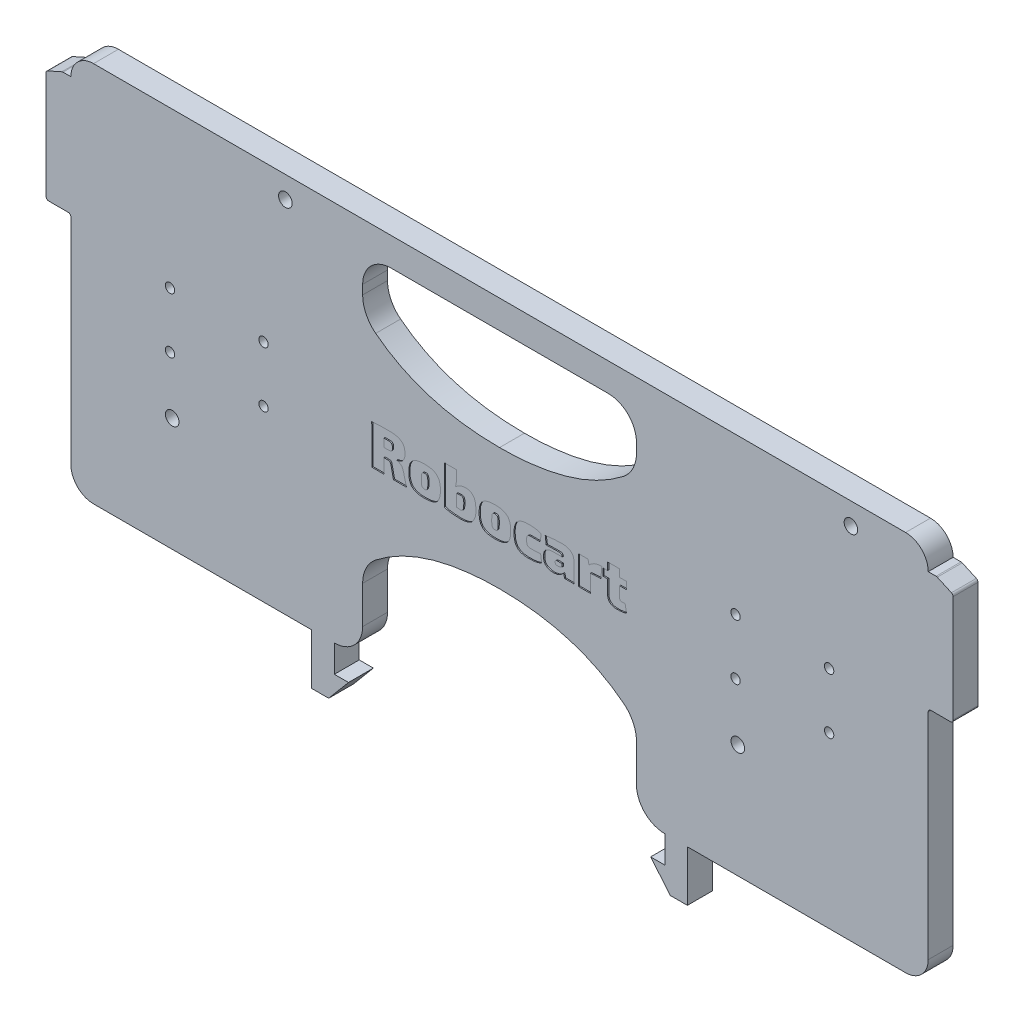
from build123d import *

# Parameters (mm, degrees)
SKETCH1_R           = 1.05
SKETCH1_R_2         = 1.524
BOSS_EXTRUDE1_DEPTH = 5.588
CUT_EXTRUDE1_DEPTH  = 0.254
SKETCH3_W           = 61.475112
SKETCH3_H           = 6.35
BOSS_EXTRUDE2_DEPTH = 5.588
FILLET1_R           = 5.08
FILLET2_R           = 6.35
FILLET3_R           = 7.62
BOSS_EXTRUDE3_DEPTH = 5.588
FILLET4_R           = 0.635
BOSS_EXTRUDE4_DEPTH = 5.588


with BuildPart() as part:
    # Sketch1 → Boss-Extrude1 (new body)
    with BuildSketch(Plane.XY):
        with BuildLine():
            Line((-96.237552, 42.800016), (-30.737556, 42.800016))
            Line((-30.737556, 42.800016), (-30.737556, 24.594089789))
            add(Edge.make_bspline(
                [(-30.737556, 24.594089789), (-19.663465212, 13.732458897), (0, 13.732458897)],
                knots=[0, 0, 0, 1, 1, 1], degree=2))
            add(Edge.make_bspline(
                [(30.737556, 24.594089789), (19.663465212, 13.732458897), (0, 13.732458897)],
                knots=[0, 0, 0, 1, 1, 1], degree=2))
            Line((30.737556, 24.594089789), (30.737556, 42.800016))
            Line((30.737556, 42.800016), (96.237552, 42.800016))
            Line((96.237552, 42.800016), (96.237552, -42.800016))
            Line((96.237552, -42.800016), (30.737556, -42.800016))
            Line((30.737556, -42.800016), (30.737556, -24.594089789))
            add(Edge.make_bspline(
                [(30.737556, -24.594089789), (19.663465212, -13.732458897), (0, -13.732458897)],
                knots=[0, 0, 0, 1, 1, 1], degree=2))
            add(Edge.make_bspline(
                [(-30.737556, -24.594089789), (-19.663465212, -13.732458897), (0, -13.732458897)],
                knots=[0, 0, 0, 1, 1, 1], degree=2))
            Line((-30.737556, -24.594089789), (-30.737556, -42.800016))
            Line((-30.737556, -42.800016), (-96.237552, -42.800016))
            Line((-96.237552, -42.800016), (-96.237552, 42.800016))
        make_face()
        with Locations((-73.987554, 7.775016)):
            Circle(SKETCH1_R, mode=Mode.SUBTRACT)
        with Locations((-73.987554, -4.724984)):
            Circle(SKETCH1_R, mode=Mode.SUBTRACT)
        with Locations((-73.48743494, -17.299967432)):
            Circle(SKETCH1_R_2, mode=Mode.SUBTRACT)
        with Locations((-52.987554, -4.724984)):
            Circle(SKETCH1_R, mode=Mode.SUBTRACT)
        with Locations((-52.987554, 7.775016)):
            Circle(SKETCH1_R, mode=Mode.SUBTRACT)
        with Locations((-48.08743494, 37.900032658)):
            Circle(SKETCH1_R_2, mode=Mode.SUBTRACT)
        with Locations((52.987554, 7.775016)):
            Circle(SKETCH1_R, mode=Mode.SUBTRACT)
        with Locations((52.987554, -4.724984)):
            Circle(SKETCH1_R, mode=Mode.SUBTRACT)
        with Locations((53.48767306, -17.299967432)):
            Circle(SKETCH1_R_2, mode=Mode.SUBTRACT)
        with Locations((73.987554, -4.724984)):
            Circle(SKETCH1_R, mode=Mode.SUBTRACT)
        with Locations((73.987554, 7.775016)):
            Circle(SKETCH1_R, mode=Mode.SUBTRACT)
        with Locations((78.88767306, 37.900032658)):
            Circle(SKETCH1_R_2, mode=Mode.SUBTRACT)
    extrude(amount=BOSS_EXTRUDE1_DEPTH)

    # Sketch2 → Cut-Extrude1 (cut)
    # profile 1 of 8: a face of its own
    with BuildSketch(Plane.XY.offset(5.588)):
        with BuildLine():
            Line((-20.890812959, -4.42227741), (-21.585380443, -1.716054946))
            add(Edge.make_bspline(
                [(-21.585380443, -1.716054946), (-21.60234828, -1.653306269), (-21.635292736, -1.531474533), (-21.691189114, -1.356694313), (-21.758925017, -1.19846087), (-21.832380902, -1.054165756), (-21.916098631, -0.926896435), (-22.004915512, -0.8132369), (-22.104350893, -0.71808226), (-22.243511952, -0.614257437), (-22.422280397, -0.513687987), (-22.633173863, -0.416456242), (-22.839405402, -0.350151259), (-22.977407352, -0.333891862), (-23.043977594, -0.326048553)],
                knots=[0, 0, 0, 0, 1.077305702, 2.091677954, 3.037688743, 3.926929695, 4.771153773, 5.558605575, 6.312393956, 7.044123723, 8.430977119, 9.701515358, 10.89124264, 12, 12, 12, 12], degree=3))
            Line((-23.043977594, -0.326048553), (-23.043202188, -0.24710396))
            add(Edge.make_bspline(
                [(-23.043202188, -0.24710396), (-22.961648182, -0.235586825), (-22.803433142, -0.213243544), (-22.576590253, -0.162297679), (-22.369683852, -0.092898274), (-22.181455484, -0.011293229), (-22.010290323, 0.082211519), (-21.861641634, 0.195300102), (-21.729587051, 0.319444944), (-21.62000232, 0.460350979), (-21.529137974, 0.611799621), (-21.444879897, 0.767621728), (-21.3802961, 0.933614593), (-21.322452804, 1.104979452), (-21.282907265, 1.284906948), (-21.255605422, 1.471537149), (-21.237278176, 1.664812301), (-21.23834801, 1.79623051), (-21.238892035, 1.863058292)],
                knots=[0, 0, 0, 0, 1.26978194, 2.463381128, 3.579096605, 4.629624065, 5.624356077, 6.577924219, 7.501901734, 8.4118476, 9.319542298, 10.223774319, 11.139249399, 12.061995962, 13.010448794, 13.974684905, 14.970102261, 16, 16, 16, 16], degree=3))
            add(Edge.make_bspline(
                [(-21.238892035, 1.863058292), (-21.240256716, 1.986242824), (-21.242884818, 2.223471436), (-21.284426706, 2.564530422), (-21.352323062, 2.876779758), (-21.447710673, 3.161146698), (-21.574491945, 3.415933184), (-21.730194324, 3.641304277), (-21.913280002, 3.83922773), (-22.129167363, 4.005448301), (-22.374164655, 4.147373318), (-22.650731763, 4.267903578), (-22.959865338, 4.36549173), (-23.298835066, 4.450868825), (-23.671491226, 4.509440489), (-24.075777802, 4.552186848), (-24.512417695, 4.573794748), (-24.813795877, 4.573580295), (-24.969649547, 4.573469393)],
                knots=[0, 0, 0, 0, 1.104208727, 2.126483719, 3.075171058, 3.966171587, 4.809496057, 5.618738063, 6.415337279, 7.217477855, 8.052665404, 8.949189943, 9.917359153, 10.957177015, 12.081428767, 13.297225691, 14.602296653, 16, 16, 16, 16], degree=3))
            add(Edge.make_bspline(
                [(-24.969649547, 4.573469393), (-25.171246857, 4.57383093), (-25.555893756, 4.574520739), (-26.1037831, 4.569878918), (-26.594232421, 4.565965796), (-27.173214222, 4.550526818), (-27.867258208, 4.519956874), (-28.415481015, 4.470497951), (-28.692986358, 4.445462298)],
                knots=[0, 0, 0, 0, 0.973558164, 1.857545264, 2.645999097, 3.342055079, 4.654572721, 6, 6, 6, 6], degree=3))
            Line((-28.692986358, 4.445462298), (-28.691132995, -4.42227741))
            Line((-28.691132995, -4.42227741), (-25.975154555, -4.42227741))
            Line((-25.975154555, -4.42227741), (-25.975154555, -1.205403453))
            Line((-25.975154555, -1.205403453), (-25.131903106, -1.205403453))
            add(Edge.make_bspline(
                [(-25.131903106, -1.205403453), (-25.078394892, -1.206100378), (-24.978614284, -1.207399985), (-24.838379777, -1.226282521), (-24.720935902, -1.264852858), (-24.620671988, -1.319937001), (-24.542049012, -1.403714504), (-24.476694004, -1.512247473), (-24.426118027, -1.649799219), (-24.403163241, -1.751732743), (-24.390834856, -1.806478436)],
                knots=[0, 0, 0, 0, 1.193247076, 2.225133473, 3.141087189, 3.938333415, 4.747893053, 5.670469204, 6.74887306, 8, 8, 8, 8], degree=3))
            Line((-24.390834856, -1.806478436), (-23.817266832, -4.42227741))
            Line((-23.817266832, -4.42227741), (-20.890812959, -4.42227741))
        make_face()
        with BuildLine():
            Line((-25.975154555, 0.77592557), (-25.975154555, 2.593993733))
            Line((-25.975154555, 2.593993733), (-25.031216365, 2.593993733))
            add(Edge.make_bspline(
                [(-25.031216365, 2.593993733), (-24.943779106, 2.593800125), (-24.782448354, 2.593442898), (-24.561657003, 2.560837317), (-24.382723064, 2.506815587), (-24.242123796, 2.420186603), (-24.146823049, 2.29024448), (-24.084831482, 2.123997041), (-24.051695641, 1.916929857), (-24.051463833, 1.765469408), (-24.051337777, 1.683106288)],
                knots=[0, 0, 0, 0, 1.314294372, 2.425008512, 3.346034536, 4.11257004, 4.862605474, 5.723121957, 6.761849854, 8, 8, 8, 8], degree=3))
            add(Edge.make_bspline(
                [(-24.051337777, 1.683106288), (-24.051494199, 1.60136292), (-24.051782842, 1.450523102), (-24.084833724, 1.24407129), (-24.146822549, 1.077822028), (-24.242124009, 0.947885094), (-24.382722641, 0.861235743), (-24.561658929, 0.807312235), (-24.782923093, 0.774149344), (-24.944779637, 0.775300229), (-25.032725507, 0.77592557)],
                knots=[0, 0, 0, 0, 1.229150822, 2.268133684, 3.128861388, 3.879080924, 4.645804581, 5.567056679, 6.678043453, 8, 8, 8, 8], degree=3))
            Line((-25.032725507, 0.77592557), (-25.975154555, 0.77592557))
        make_face(mode=Mode.SUBTRACT)
    # profile 2 of 8: a face of its own
    with BuildSketch(Plane.XY.offset(5.588)):
        with BuildLine():
            add(Edge.make_bspline(
                [(-16.819284746, 2.093098216), (-16.97413566, 2.092514592), (-17.272258361, 2.091390985), (-17.702472396, 2.059381435), (-18.099047111, 2.005559164), (-18.461575763, 1.924361367), (-18.790145018, 1.81958707), (-19.084112325, 1.689459959), (-19.345156355, 1.535360693), (-19.573086415, 1.353512488), (-19.769710364, 1.141351159), (-19.937342632, 0.897284821), (-20.078895519, 0.620502671), (-20.191050622, 0.309724589), (-20.277712941, -0.033383298), (-20.337495511, -0.409589901), (-20.37353898, -0.818808557), (-20.374092964, -1.102670224), (-20.374380348, -1.249925849)],
                knots=[0, 0, 0, 0, 1.301138732, 2.504983567, 3.622955002, 4.661926955, 5.623444867, 6.516867694, 7.358299959, 8.164315082, 8.958683684, 9.780463849, 10.645170289, 11.564345272, 12.55137133, 13.615162501, 14.76284551, 16, 16, 16, 16], degree=3))
            add(Edge.make_bspline(
                [(-20.374380348, -1.249925849), (-20.374078325, -1.394708056), (-20.373495189, -1.67424809), (-20.33752487, -2.077307742), (-20.277720336, -2.447961271), (-20.191164808, -2.785599934), (-20.078442117, -3.091196065), (-19.937475578, -3.364007401), (-19.76896937, -3.604224034), (-19.573741617, -3.814780938), (-19.343824911, -3.992042626), (-19.084708091, -4.147167672), (-18.789911782, -4.274699817), (-18.461514073, -4.377809977), (-18.098960161, -4.457251275), (-17.702322329, -4.508485505), (-17.272484297, -4.541752788), (-16.974530579, -4.541261725), (-16.819864489, -4.541006817)],
                knots=[0, 0, 0, 0, 1.225303258, 2.365769401, 3.421876917, 4.400943223, 5.312143672, 6.173900677, 6.993129972, 7.789505327, 8.594933318, 9.442546689, 10.340413257, 11.307394121, 12.352858382, 13.478324105, 14.691012305, 16, 16, 16, 16], degree=3))
            add(Edge.make_bspline(
                [(-16.819864489, -4.541006817), (-16.665816649, -4.541262014), (-16.369097825, -4.541753562), (-15.941109138, -4.508497136), (-15.546324883, -4.457243765), (-15.185591569, -4.377877732), (-14.85857331, -4.2743571), (-14.564366387, -4.147096532), (-14.305322931, -3.99264487), (-14.076991226, -3.814137567), (-13.88195559, -3.604239921), (-13.7130525, -3.364483228), (-13.574730594, -3.090645114), (-13.461385497, -2.785684131), (-13.375044234, -2.447936065), (-13.315175572, -2.077315279), (-13.279224155, -1.674245977), (-13.278638292, -1.394707335), (-13.278334856, -1.249925849)],
                knots=[0, 0, 0, 0, 1.306386535, 2.516292846, 3.638834432, 4.681288433, 5.645225056, 6.544905627, 7.394231473, 8.197166916, 8.995151228, 9.816035651, 10.677123946, 11.590165338, 12.571209699, 13.62945092, 14.772221202, 16, 16, 16, 16], degree=3))
            add(Edge.make_bspline(
                [(-13.278334856, -1.249925849), (-13.278623673, -1.102670946), (-13.27918042, -0.81881067), (-13.31520478, -0.409582391), (-13.375052206, -0.033408449), (-13.461497561, 0.309808702), (-13.574286434, 0.619954578), (-13.71318004, 0.897756873), (-13.881212081, 1.141369059), (-14.07765611, 1.352869975), (-14.303983876, 1.535958773), (-14.564963577, 1.689388759), (-14.858343979, 1.819240033), (-15.185528616, 1.924423748), (-15.546237329, 2.0055779), (-15.940959854, 2.059283381), (-16.369115924, 2.09183529), (-16.665822834, 2.091446632), (-16.819864489, 2.091244853)],
                knots=[0, 0, 0, 0, 1.239761575, 2.389863124, 3.455896047, 4.445002089, 5.366114071, 6.230275951, 7.053787873, 7.849830466, 8.653486971, 9.496692405, 10.391997964, 11.35058848, 12.386669903, 13.50184006, 14.703027546, 16, 16, 16, 16], degree=3))
            Line((-16.819864489, 2.091244853), (-16.819284746, 2.093098216))
        make_face()
        with BuildLine():
            add(Edge.make_bspline(
                [(-16.819284746, 0.326971338), (-16.785442741, 0.327821409), (-16.719822991, 0.329469699), (-16.625321341, 0.317998301), (-16.538938448, 0.297302757), (-16.459721768, 0.269344943), (-16.391688021, 0.224454445), (-16.332021704, 0.17076917), (-16.281134406, 0.105913552), (-16.23734202, 0.029976842), (-16.202641622, -0.062396732), (-16.17051329, -0.171854386), (-16.148523542, -0.302750535), (-16.127360209, -0.452959603), (-16.114014838, -0.623970625), (-16.10172416, -0.81440224), (-16.099570143, -1.025452092), (-16.099889014, -1.172631491), (-16.100056475, -1.249925849)],
                knots=[0, 0, 0, 0, 0.815282387, 1.580835021, 2.285938702, 2.955970902, 3.59284183, 4.236654335, 4.883909712, 5.571782011, 6.34138828, 7.256745613, 8.318150629, 9.536784446, 10.913497992, 12.451627213, 14.136497401, 16, 16, 16, 16], degree=3))
            add(Edge.make_bspline(
                [(-16.100056475, -1.249925849), (-16.099891545, -1.324746442), (-16.099576654, -1.467596998), (-16.101710948, -1.672469372), (-16.114006416, -1.857333069), (-16.127285992, -2.022801886), (-16.148676197, -2.168027712), (-16.170394149, -2.29466828), (-16.202898076, -2.400970493), (-16.246820987, -2.515256939), (-16.325273694, -2.631515505), (-16.460539501, -2.727892438), (-16.631001643, -2.777986792), (-16.754007407, -2.775963308), (-16.819864489, -2.774879939)],
                knots=[0, 0, 0, 0, 1.385054146, 2.644402385, 3.791133793, 4.814000026, 5.715679688, 6.508153822, 7.189017703, 7.76931152, 8.772713745, 9.732124418, 10.785783184, 12, 12, 12, 12], degree=3))
            add(Edge.make_bspline(
                [(-16.819864489, -2.774879939), (-16.887611389, -2.776108788), (-17.013125149, -2.778385459), (-17.186696782, -2.727379164), (-17.325289427, -2.632377439), (-17.405654012, -2.515596719), (-17.450336003, -2.40128003), (-17.479246885, -2.294065865), (-17.505056579, -2.168367814), (-17.524944147, -2.022723103), (-17.539537697, -1.857425218), (-17.547767385, -1.672359316), (-17.554077368, -1.467641268), (-17.55314633, -1.324756829), (-17.552658729, -1.249925849)],
                knots=[0, 0, 0, 0, 1.241376632, 2.299881571, 3.272351116, 4.276537072, 4.853504633, 5.527301281, 6.317449116, 7.213960333, 8.230963477, 9.370496789, 10.622885011, 12, 12, 12, 12], degree=3))
            add(Edge.make_bspline(
                [(-17.552658729, -1.249925849), (-17.553151134, -1.172621306), (-17.554088831, -1.025408835), (-17.547755012, -0.814509286), (-17.539534499, -0.623880164), (-17.524860821, -0.453039169), (-17.505234131, -0.302410574), (-17.47908311, -0.172461501), (-17.450695104, -0.062033683), (-17.415097048, 0.029822361), (-17.371864266, 0.10664341), (-17.318610566, 0.170015538), (-17.258847704, 0.225816027), (-17.187958471, 0.268236763), (-17.10780103, 0.297846784), (-17.019896646, 0.317769208), (-16.922807934, 0.330022041), (-16.855140933, 0.32679849), (-16.819864489, 0.325117974)],
                knots=[0, 0, 0, 0, 1.852277897, 3.527327117, 5.055401374, 6.423822364, 7.635115809, 8.692933536, 9.598786439, 10.363757028, 11.047485967, 11.700160994, 12.340095531, 12.998298253, 13.664294552, 14.379571275, 15.155231305, 16, 16, 16, 16], degree=3))
            Line((-16.819864489, 0.325117974), (-16.819284746, 0.326971338))
        make_face(mode=Mode.SUBTRACT)
    # profile 3 of 8: a face of its own
    with BuildSketch(Plane.XY.offset(5.588)):
        with BuildLine():
            Line((-9.720108646, 4.586453809), (-12.413824981, 4.586453809))
            Line((-12.413824981, 4.586453809), (-12.413824981, -4.014912439))
            add(Edge.make_bspline(
                [(-12.413824981, -4.014912439), (-12.360281093, -4.038173558), (-12.248958831, -4.086535388), (-12.070337061, -4.148968711), (-11.875530653, -4.2055654), (-11.666552823, -4.259447256), (-11.442568718, -4.307944073), (-11.202871536, -4.349741616), (-10.948143926, -4.388998348), (-10.594395264, -4.431812719), (-10.159646254, -4.474678576), (-9.660597801, -4.514610928), (-9.198427994, -4.538473691), (-8.902619508, -4.540186638), (-8.76098302, -4.541006817)],
                knots=[0, 0, 0, 0, 0.566143425, 1.17705996, 1.833791331, 2.533600597, 3.270136108, 4.056160048, 4.893498106, 5.769972827, 7.512277332, 9.130813025, 10.626200442, 12, 12, 12, 12], degree=3))
            add(Edge.make_bspline(
                [(-8.76098302, -4.541006817), (-8.673750892, -4.538697032), (-8.502822426, -4.534171086), (-8.253003547, -4.514336504), (-8.014120063, -4.490695082), (-7.786646499, -4.460404235), (-7.570541976, -4.418004726), (-7.365208647, -4.373103382), (-7.171433301, -4.31897461), (-6.989338788, -4.257792569), (-6.817745277, -4.189723437), (-6.659005139, -4.111665112), (-6.510927245, -4.027440848), (-6.373518913, -3.937656382), (-6.248590128, -3.837763636), (-6.133122352, -3.733076493), (-6.030478503, -3.618942655), (-5.910265873, -3.457458031), (-5.77818137, -3.245100146), (-5.642834841, -2.978970257), (-5.528251797, -2.703419122), (-5.439842351, -2.416196376), (-5.372365448, -2.119221039), (-5.33079205, -1.811338178), (-5.308801775, -1.493850189), (-5.314759082, -1.279012546), (-5.317777677, -1.170153311)],
                knots=[0, 0, 0, 0, 1.127999254, 2.210277188, 3.238897676, 4.23162696, 5.17557524, 6.085246793, 6.948444366, 7.775179884, 8.56797293, 9.333154585, 10.060037587, 10.769610838, 11.452607753, 12.125943687, 12.782602808, 13.433395291, 14.726629494, 16.010264116, 17.290083694, 18.579729525, 19.890904527, 21.222829017, 22.592794515, 24, 24, 24, 24], degree=3))
            add(Edge.make_bspline(
                [(-5.317777677, -1.170153311), (-5.317641234, -1.031611735), (-5.317377886, -0.76421563), (-5.339203205, -0.377650226), (-5.381092734, -0.020675152), (-5.433193735, 0.308252402), (-5.51140048, 0.606277882), (-5.599493477, 0.876591589), (-5.710024521, 1.116635587), (-5.837890656, 1.329015797), (-5.988671704, 1.514248387), (-6.162299301, 1.673299855), (-6.360710448, 1.805738456), (-6.58040294, 1.916983365), (-6.826893205, 1.996520335), (-7.094981015, 2.056599329), (-7.387340114, 2.089240586), (-7.589674077, 2.091784909), (-7.694257227, 2.093100028)],
                knots=[0, 0, 0, 0, 1.421889281, 2.744357793, 3.971045822, 5.110570847, 6.158979495, 7.130494519, 8.025127154, 8.865537539, 9.668536019, 10.468266483, 11.27281888, 12.110227575, 12.987396072, 13.923728139, 14.926808692, 16, 16, 16, 16], degree=3))
            add(Edge.make_bspline(
                [(-7.694257227, 2.093100028), (-7.799610305, 2.087958955), (-8.008527493, 2.077764108), (-8.317129052, 2.022270188), (-8.616425322, 1.935515831), (-8.902964949, 1.81505682), (-9.174968953, 1.67511454), (-9.43034544, 1.519878497), (-9.669226299, 1.354268249), (-9.815043458, 1.230407592), (-9.887074422, 1.169222732)],
                knots=[0, 0, 0, 0, 1.041431214, 2.065178201, 3.090091768, 4.114841366, 5.131524032, 6.110368693, 7.066557293, 8, 8, 8, 8], degree=3))
            add(Edge.make_bspline(
                [(-9.887074422, 1.169222732), (-9.854009428, 1.293045427), (-9.787614217, 1.541684029), (-9.726481702, 1.926183089), (-9.691326829, 2.320601653), (-9.693192165, 2.587121532), (-9.694136191, 2.722004452)],
                knots=[0, 0, 0, 0, 0.978525379, 1.96489976, 2.970057081, 4, 4, 4, 4], degree=3))
            Line((-9.694136191, 2.722004452), (-9.720108646, 4.586453809))
        make_face()
        with BuildLine():
            add(Edge.make_bspline(
                [(-9.720108646, -0.07398748), (-9.659967508, -0.050778787), (-9.535091773, -0.002588766), (-9.330803095, 0.042682597), (-9.107814482, 0.077928397), (-8.951604908, 0.084329514), (-8.870438362, 0.087655537)],
                knots=[0, 0, 0, 0, 0.888373905, 1.844600052, 2.880053484, 4, 4, 4, 4], degree=3))
            add(Edge.make_bspline(
                [(-8.870438362, 0.087655537), (-8.795975441, 0.088228306), (-8.657875293, 0.089290572), (-8.467731172, 0.046657078), (-8.310687193, -0.028483128), (-8.214876752, -0.129255441), (-8.157630284, -0.227242141), (-8.121525712, -0.318016759), (-8.092686727, -0.424633105), (-8.068405949, -0.546730141), (-8.050822761, -0.684979256), (-8.037414646, -0.839677222), (-8.032693051, -1.010581532), (-8.033389785, -1.129959061), (-8.033754305, -1.192415415)],
                knots=[0, 0, 0, 0, 1.480574637, 2.745897867, 3.854410053, 4.900898594, 5.459220732, 6.111846885, 6.841895749, 7.659301981, 8.592332102, 9.619461279, 10.75454141, 12, 12, 12, 12], degree=3))
            add(Edge.make_bspline(
                [(-8.033754305, -1.192415415), (-8.034182063, -1.267239611), (-8.035002356, -1.410726905), (-8.039188705, -1.616220654), (-8.052561631, -1.802464914), (-8.070646087, -1.969631455), (-8.094052316, -2.117814477), (-8.123558018, -2.246818978), (-8.157689447, -2.356646633), (-8.211051809, -2.474772728), (-8.299119208, -2.596607969), (-8.442154194, -2.702195581), (-8.618818119, -2.765435599), (-8.746824044, -2.771604719), (-8.814783103, -2.774879939)],
                knots=[0, 0, 0, 0, 1.341428161, 2.572401811, 3.683694972, 4.687557271, 5.586054722, 6.371270954, 7.058412011, 7.643759289, 8.690296819, 9.712417619, 10.785509759, 12, 12, 12, 12], degree=3))
            add(Edge.make_bspline(
                [(-8.814783103, -2.774879939), (-8.877797514, -2.76513818), (-9.016476732, -2.743698967), (-9.237706277, -2.720446484), (-9.47659165, -2.695691774), (-9.639117385, -2.676729313), (-9.720108646, -2.667279772)],
                knots=[0, 0, 0, 0, 0.839061258, 1.84656741, 2.926882437, 4, 4, 4, 4], degree=3))
            Line((-9.720108646, -2.667279772), (-9.720108646, -0.07398748))
        make_face(mode=Mode.SUBTRACT)
    # profile 4 of 8: a face of its own
    with BuildSketch(Plane.XY.offset(5.588)):
        with BuildLine():
            add(Edge.make_bspline(
                [(-1.02803266, 2.093098216), (-1.182883573, 2.092514592), (-1.481006275, 2.091390985), (-1.911220309, 2.059381435), (-2.307795025, 2.005559164), (-2.670323676, 1.924361367), (-2.998892931, 1.81958707), (-3.292860238, 1.689459959), (-3.553904268, 1.535360693), (-3.781834329, 1.353512488), (-3.978458277, 1.141351159), (-4.146090545, 0.897284821), (-4.287643432, 0.620502671), (-4.399798535, 0.309724589), (-4.486460854, -0.033383298), (-4.546243425, -0.409589901), (-4.582286893, -0.818808557), (-4.582840878, -1.102670224), (-4.583128262, -1.249925849)],
                knots=[0, 0, 0, 0, 1.301138732, 2.504983567, 3.622955002, 4.661926955, 5.623444867, 6.516867694, 7.358299959, 8.164315082, 8.958683684, 9.780463849, 10.645170289, 11.564345272, 12.55137133, 13.615162501, 14.76284551, 16, 16, 16, 16], degree=3))
            add(Edge.make_bspline(
                [(-4.583128262, -1.249925849), (-4.582826238, -1.394708056), (-4.582243102, -1.67424809), (-4.546272783, -2.077307742), (-4.486468249, -2.447961271), (-4.399912722, -2.785599934), (-4.28719003, -3.091196065), (-4.146223491, -3.364007401), (-3.977717283, -3.604224034), (-3.78248953, -3.814780938), (-3.552572824, -3.992042626), (-3.293456004, -4.147167672), (-2.998659695, -4.274699817), (-2.670261986, -4.377809977), (-2.307708075, -4.457251275), (-1.911070242, -4.508485505), (-1.48123221, -4.541752788), (-1.183278492, -4.541261725), (-1.028612402, -4.541006817)],
                knots=[0, 0, 0, 0, 1.225303258, 2.365769401, 3.421876917, 4.400943223, 5.312143672, 6.173900677, 6.993129972, 7.789505327, 8.594933318, 9.442546689, 10.340413257, 11.307394121, 12.352858382, 13.478324105, 14.691012305, 16, 16, 16, 16], degree=3))
            add(Edge.make_bspline(
                [(-1.028612402, -4.541006817), (-0.874564562, -4.541262014), (-0.577845738, -4.541753562), (-0.149857051, -4.508497136), (0.244927204, -4.457243765), (0.605660517, -4.377877732), (0.932678777, -4.2743571), (1.2268857, -4.147096532), (1.485929156, -3.99264487), (1.714260861, -3.814137567), (1.909296496, -3.604239921), (2.078199587, -3.364483228), (2.216521492, -3.090645114), (2.32986659, -2.785684131), (2.416207853, -2.447936065), (2.476076514, -2.077315279), (2.512027932, -1.674245977), (2.512613795, -1.394707335), (2.512917231, -1.249925849)],
                knots=[0, 0, 0, 0, 1.306386535, 2.516292846, 3.638834432, 4.681288433, 5.645225056, 6.544905627, 7.394231473, 8.197166916, 8.995151228, 9.816035651, 10.677123946, 11.590165338, 12.571209699, 13.62945092, 14.772221202, 16, 16, 16, 16], degree=3))
            add(Edge.make_bspline(
                [(2.512917231, -1.249925849), (2.512628414, -1.102670946), (2.512071667, -0.81881067), (2.476047306, -0.409582391), (2.416199881, -0.033408449), (2.329754526, 0.309808702), (2.216965653, 0.619954578), (2.078072047, 0.897756873), (1.910040006, 1.141369059), (1.713595977, 1.352869975), (1.48726821, 1.535958773), (1.22628851, 1.689388759), (0.932908108, 1.819240033), (0.605723471, 1.924423748), (0.245014758, 2.0055779), (-0.149707768, 2.059283381), (-0.577863837, 2.09183529), (-0.874570747, 2.091446632), (-1.028612402, 2.091244853)],
                knots=[0, 0, 0, 0, 1.239761575, 2.389863124, 3.455896047, 4.445002089, 5.366114071, 6.230275951, 7.053787873, 7.849830466, 8.653486971, 9.496692405, 10.391997964, 11.35058848, 12.386669903, 13.50184006, 14.703027546, 16, 16, 16, 16], degree=3))
            Line((-1.028612402, 2.091244853), (-1.02803266, 2.093098216))
        make_face()
        with BuildLine():
            add(Edge.make_bspline(
                [(-1.02803266, 0.326971338), (-0.994190655, 0.327821409), (-0.928570904, 0.329469699), (-0.834069254, 0.317998301), (-0.747686361, 0.297302757), (-0.668469681, 0.269344943), (-0.600435935, 0.224454445), (-0.540769617, 0.17076917), (-0.489882319, 0.105913552), (-0.446089933, 0.029976842), (-0.411389535, -0.062396732), (-0.379261203, -0.171854386), (-0.357271455, -0.302750535), (-0.336108122, -0.452959603), (-0.322762751, -0.623970625), (-0.310472073, -0.81440224), (-0.308318056, -1.025452092), (-0.308636927, -1.172631491), (-0.308804388, -1.249925849)],
                knots=[0, 0, 0, 0, 0.815282387, 1.580835021, 2.285938702, 2.955970902, 3.59284183, 4.236654335, 4.883909712, 5.571782011, 6.34138828, 7.256745613, 8.318150629, 9.536784446, 10.913497992, 12.451627213, 14.136497401, 16, 16, 16, 16], degree=3))
            add(Edge.make_bspline(
                [(-0.308804388, -1.249925849), (-0.308639458, -1.324746442), (-0.308324567, -1.467596998), (-0.310458861, -1.672469372), (-0.322754329, -1.857333069), (-0.336033906, -2.022801886), (-0.35742411, -2.168027712), (-0.379142062, -2.29466828), (-0.411645989, -2.400970493), (-0.4555689, -2.515256939), (-0.534021608, -2.631515505), (-0.669287414, -2.727892438), (-0.839749556, -2.777986792), (-0.96275532, -2.775963308), (-1.028612402, -2.774879939)],
                knots=[0, 0, 0, 0, 1.385054146, 2.644402385, 3.791133793, 4.814000026, 5.715679688, 6.508153822, 7.189017703, 7.76931152, 8.772713745, 9.732124418, 10.785783184, 12, 12, 12, 12], degree=3))
            add(Edge.make_bspline(
                [(-1.028612402, -2.774879939), (-1.096359302, -2.776108788), (-1.221873062, -2.778385459), (-1.395444695, -2.727379164), (-1.534037341, -2.632377439), (-1.614401925, -2.515596719), (-1.659083917, -2.40128003), (-1.687994798, -2.294065865), (-1.713804492, -2.168367814), (-1.73369206, -2.022723103), (-1.74828561, -1.857425218), (-1.756515298, -1.672359316), (-1.762825282, -1.467641268), (-1.761894243, -1.324756829), (-1.761406642, -1.249925849)],
                knots=[0, 0, 0, 0, 1.241376632, 2.299881571, 3.272351116, 4.276537072, 4.853504633, 5.527301281, 6.317449116, 7.213960333, 8.230963477, 9.370496789, 10.622885011, 12, 12, 12, 12], degree=3))
            add(Edge.make_bspline(
                [(-1.761406642, -1.249925849), (-1.761899048, -1.172621306), (-1.762836744, -1.025408835), (-1.756502925, -0.814509286), (-1.748282412, -0.623880164), (-1.733608734, -0.453039169), (-1.713982044, -0.302410574), (-1.687831023, -0.172461501), (-1.659443018, -0.062033683), (-1.623844961, 0.029822361), (-1.58061218, 0.10664341), (-1.527358479, 0.170015538), (-1.467595617, 0.225816027), (-1.396706384, 0.268236763), (-1.316548944, 0.297846784), (-1.228644559, 0.317769208), (-1.131555847, 0.330022041), (-1.063888846, 0.32679849), (-1.028612402, 0.325117974)],
                knots=[0, 0, 0, 0, 1.852277897, 3.527327117, 5.055401374, 6.423822364, 7.635115809, 8.692933536, 9.598786439, 10.363757028, 11.047485967, 11.700160994, 12.340095531, 12.998298253, 13.664294552, 14.379571275, 15.155231305, 16, 16, 16, 16], degree=3))
            Line((-1.028612402, 0.325117974), (-1.02803266, 0.326971338))
        make_face(mode=Mode.SUBTRACT)
    # profile 5 of 8: a face of its own
    with BuildSketch(Plane.XY.offset(5.588)):
        with BuildLine():
            add(Edge.make_bspline(
                [(9.217147528, -2.332018435), (9.016425172, -2.350910119), (8.626470539, -2.387612058), (8.147249699, -2.4082606), (7.790283379, -2.414703435), (7.553444415, -2.419573146), (7.343174032, -2.418506403), (7.212075842, -2.418629022), (7.150855461, -2.418686283)],
                knots=[0, 0, 0, 0, 1.753605035, 3.406827339, 4.170886547, 4.859546372, 5.467429674, 6, 6, 6, 6], degree=3))
            add(Edge.make_bspline(
                [(7.150855461, -2.418686283), (7.102602223, -2.419425941), (7.009083097, -2.420859464), (6.874659701, -2.410917128), (6.750948665, -2.395375389), (6.639384349, -2.368911468), (6.538106388, -2.336317871), (6.448892722, -2.29381985), (6.37092905, -2.242585567), (6.30270183, -2.18310669), (6.245641009, -2.109754543), (6.198146124, -2.023657878), (6.156456198, -1.924429627), (6.126720711, -1.809826293), (6.0998359, -1.682524703), (6.084415346, -1.540279118), (6.07490956, -1.38425639), (6.074872926, -1.275297293), (6.074853792, -1.218387869)],
                knots=[0, 0, 0, 0, 1.209474384, 2.344070404, 3.376943074, 4.332298939, 5.214920591, 6.040246273, 6.80146698, 7.548338784, 8.299063779, 9.118395519, 10.008206862, 10.990122684, 12.081843351, 13.268539912, 14.5733562, 16, 16, 16, 16], degree=3))
            add(Edge.make_bspline(
                [(6.074853792, -1.218387869), (6.074874818, -1.162714562), (6.074915269, -1.055608191), (6.084537969, -0.901452201), (6.099673601, -0.760410078), (6.126613835, -0.634309634), (6.156904472, -0.521163908), (6.197568, -0.422686868), (6.246223602, -0.337867617), (6.302636541, -0.264761417), (6.370948628, -0.205339746), (6.448879861, -0.154049992), (6.538140121, -0.111732751), (6.639121074, -0.078444244), (6.751242359, -0.055074555), (6.874611159, -0.038629435), (7.009096675, -0.028962752), (7.102606844, -0.030356531), (7.150855461, -0.031075682)],
                knots=[0, 0, 0, 0, 1.403834989, 2.700749752, 3.89441997, 4.977274868, 5.949945309, 6.844985653, 7.655590205, 8.410726857, 9.161987675, 9.927681717, 10.757857448, 11.645665852, 12.603212224, 13.6421546, 14.783418105, 16, 16, 16, 16], degree=3))
            Line((7.150855461, -0.031075682), (9.101738957, -0.029222318))
            Line((9.101738957, -0.029222318), (9.371025622, 1.622952592))
            add(Edge.make_bspline(
                [(9.371025622, 1.622952592), (9.268477176, 1.665535642), (9.060949872, 1.751710966), (8.734067076, 1.854846068), (8.391458961, 1.938695225), (8.03630385, 1.997346277), (7.68139293, 2.040275533), (7.336882765, 2.072747724), (7.008193147, 2.089948086), (6.794679005, 2.090820359), (6.690771989, 2.091244853)],
                knots=[0, 0, 0, 0, 0.972227876, 1.967497694, 2.99880285, 4.059393783, 5.118240435, 6.129942292, 7.08993327, 8, 8, 8, 8], degree=3))
            add(Edge.make_bspline(
                [(6.690771989, 2.091244853), (6.540441894, 2.090631031), (6.249922625, 2.089444793), (5.831010173, 2.057613942), (5.445426537, 2.004070446), (5.094216074, 1.92196638), (4.775911196, 1.817847083), (4.491194962, 1.687565889), (4.239211738, 1.533479624), (4.020670005, 1.350790951), (3.831419659, 1.139255089), (3.672725579, 0.895283367), (3.535724065, 0.621919293), (3.427190814, 0.315154237), (3.344447533, -0.023664677), (3.288726456, -0.394352657), (3.254373305, -0.795983368), (3.253555751, -1.074228163), (3.253132172, -1.218387869)],
                knots=[0, 0, 0, 0, 1.29163422, 2.49613777, 3.607763278, 4.633916918, 5.59188115, 6.481255239, 7.3189657, 8.122602918, 8.920579095, 9.748982409, 10.616508012, 11.542797806, 12.539191396, 13.609561865, 14.761504744, 16, 16, 16, 16], degree=3))
            add(Edge.make_bspline(
                [(3.253132172, -1.218387869), (3.253793097, -1.363147428), (3.255068719, -1.642541473), (3.286202008, -2.045606558), (3.342549926, -2.416868986), (3.426048749, -2.755807033), (3.532011171, -3.064053081), (3.666565883, -3.339106532), (3.824641566, -3.583352728), (4.010547365, -3.796909722), (4.228675036, -3.979094954), (4.477860819, -4.136444844), (4.762122304, -4.264646906), (5.078432539, -4.370868027), (5.427796666, -4.450813241), (5.810355518, -4.508236766), (6.226457754, -4.539013895), (6.515100561, -4.54032621), (6.664799535, -4.541006817)],
                knots=[0, 0, 0, 0, 1.24599968, 2.404849061, 3.477104633, 4.47525304, 5.406406521, 6.277870224, 7.104806972, 7.904649351, 8.705624952, 9.543120217, 10.434060644, 11.383616389, 12.411577258, 13.515407144, 14.711414278, 16, 16, 16, 16], degree=3))
            add(Edge.make_bspline(
                [(6.664799535, -4.541006817), (6.789750967, -4.540371217), (7.039242905, -4.539102108), (7.411787683, -4.515384555), (7.782025832, -4.478928397), (8.146871812, -4.425754375), (8.50210925, -4.355596662), (8.840183218, -4.259929767), (9.160655491, -4.147050921), (9.361713036, -4.051722571), (9.4605487, -4.004861157)],
                knots=[0, 0, 0, 0, 1.044018105, 2.084602774, 3.118183006, 4.152331538, 5.164818741, 6.141594537, 7.08644693, 8, 8, 8, 8], degree=3))
            Line((9.4605487, -4.004861157), (9.217147528, -2.332018435))
        make_face()
    # profile 6 of 8: a face of its own
    with BuildSketch(Plane.XY.offset(5.588)):
        with BuildLine():
            add(Edge.make_bspline(
                [(10.482128875, 0.043301629), (10.746984164, 0.053298564), (11.259704887, 0.072651154), (11.888941767, 0.085662918), (12.36141337, 0.093385393), (12.686072833, 0.097096492), (12.986615846, 0.099157278), (13.178938123, 0.098906659), (13.27107875, 0.098786589)],
                knots=[0, 0, 0, 0, 1.710120508, 3.310540727, 4.060769019, 4.759076525, 5.405479862, 6, 6, 6, 6], degree=3))
            add(Edge.make_bspline(
                [(13.27107875, 0.098786589), (13.338598682, 0.098000092), (13.463113298, 0.096549702), (13.633969407, 0.070697519), (13.773770097, 0.030481018), (13.883891865, -0.030425939), (13.96664748, -0.112416579), (14.022031839, -0.215853717), (14.056387333, -0.338746147), (14.059643877, -0.427208604), (14.061383425, -0.474462576)],
                knots=[0, 0, 0, 0, 1.437482754, 2.650885585, 3.672155217, 4.522178022, 5.304973306, 6.11909269, 6.995276142, 8, 8, 8, 8], degree=3))
            Line((14.061383425, -0.474462576), (14.063236788, -0.518986784))
            Line((14.063236788, -0.518986784), (11.997091469, -0.518986784))
            add(Edge.make_bspline(
                [(11.997091469, -0.518986784), (11.917116329, -0.521317981), (11.761419646, -0.525856387), (11.534776346, -0.545096444), (11.322322325, -0.581064267), (11.122643486, -0.628106866), (10.93721141, -0.692333499), (10.762920994, -0.765565219), (10.603240846, -0.854824951), (10.458100415, -0.957242627), (10.327580313, -1.070395855), (10.213034132, -1.194754888), (10.119048404, -1.33217665), (10.036577967, -1.477395714), (9.977810351, -1.63594799), (9.929174723, -1.802860639), (9.902201874, -1.981252396), (9.897207456, -2.103845581), (9.894659718, -2.166382443)],
                knots=[0, 0, 0, 0, 1.276297523, 2.484713259, 3.624839222, 4.711112875, 5.753076661, 6.751786018, 7.72337871, 8.664907758, 9.580869206, 10.474730127, 11.353216372, 12.231868772, 13.131373359, 14.043341815, 15.001875481, 16, 16, 16, 16], degree=3))
            Line((9.894659718, -2.166382443), (9.896513082, -2.799230926))
            add(Edge.make_bspline(
                [(9.896513082, -2.799230926), (9.900091244, -2.86915321), (9.90706923, -3.005512825), (9.940141772, -3.202989283), (9.994521103, -3.386430802), (10.067015424, -3.556629801), (10.158556882, -3.71374597), (10.268939103, -3.85766724), (10.398012671, -3.988431712), (10.545233646, -4.104789592), (10.705582311, -4.207339632), (10.87621053, -4.297413763), (11.055570678, -4.373177282), (11.244423051, -4.434426617), (11.441642252, -4.482529884), (11.647969938, -4.518066179), (11.863833607, -4.538268084), (12.010755349, -4.541311281), (12.085621738, -4.542861992)],
                knots=[0, 0, 0, 0, 1.069588051, 2.085867437, 3.051892561, 3.987710893, 4.906912752, 5.823827612, 6.752890775, 7.707986872, 8.685961382, 9.658439035, 10.65384439, 11.658185339, 12.689821465, 13.754278346, 14.855655614, 16, 16, 16, 16], degree=3))
            add(Edge.make_bspline(
                [(12.085621738, -4.542861992), (12.21949398, -4.537269212), (12.477008323, -4.526511037), (12.845164524, -4.461656439), (13.180747188, -4.366236752), (13.478842785, -4.227110503), (13.745741422, -4.068130738), (13.98244716, -3.892081049), (14.193306336, -3.706133074), (14.311506369, -3.566648931), (14.369342523, -3.498398303)],
                knots=[0, 0, 0, 0, 1.236914107, 2.379306714, 3.44609163, 4.451073934, 5.409537877, 6.312441219, 7.174264944, 8, 8, 8, 8], degree=3))
            Line((14.369342523, -3.498398303), (14.614789099, -4.42227741))
            Line((14.614789099, -4.42227741), (16.756951312, -4.42227741))
            Line((16.756951312, -4.42227741), (16.756951312, -0.484560962))
            add(Edge.make_bspline(
                [(16.756951312, -0.484560962), (16.753642245, -0.369781178), (16.747248195, -0.147994284), (16.711421375, 0.171567842), (16.658083509, 0.465961552), (16.578253027, 0.732852431), (16.476044116, 0.972801768), (16.35191607, 1.186389998), (16.203592592, 1.372399329), (16.032896497, 1.532491256), (15.838359635, 1.664754827), (15.628058765, 1.784286601), (15.394416681, 1.878332843), (15.143245678, 1.959708225), (14.870826114, 2.017706344), (14.578826061, 2.058073931), (14.26643198, 2.080577438), (14.051524076, 2.080271453), (13.940797031, 2.080113801)],
                knots=[0, 0, 0, 0, 1.248315083, 2.412096568, 3.49367279, 4.497923714, 5.434861739, 6.324149066, 7.175950841, 8.013401396, 8.858566588, 9.728650356, 10.639147673, 11.592001417, 12.597197689, 13.663379945, 14.796102749, 16, 16, 16, 16], degree=3))
            add(Edge.make_bspline(
                [(13.940797031, 2.080113801), (13.801018206, 2.079144178), (13.51021435, 2.077126919), (13.058799439, 2.056125015), (12.574995217, 2.02965961), (12.071708292, 1.988357233), (11.570040541, 1.941792802), (11.093604418, 1.888790307), (10.653736743, 1.82822883), (10.373801548, 1.780279407), (10.239722323, 1.7573133)],
                knots=[0, 0, 0, 0, 0.901990853, 1.876553333, 2.915875848, 4.028775225, 5.135100977, 6.167234853, 7.122169215, 8, 8, 8, 8], degree=3))
            Line((10.239722323, 1.7573133), (10.482128875, 0.043301629))
        make_face()
        with BuildLine():
            add(Edge.make_bspline(
                [(12.493760303, -2.203268545), (12.495547764, -2.174066247), (12.498929748, -2.118813729), (12.524279171, -2.041573522), (12.564158562, -1.974479158), (12.620897008, -1.917307275), (12.696152279, -1.875569102), (12.784077929, -1.841918408), (12.887948059, -1.81986483), (12.962391222, -1.814763553), (13.002078333, -1.812043962)],
                knots=[0, 0, 0, 0, 0.970557884, 1.836354356, 2.676567351, 3.549916996, 4.481944709, 5.517967931, 6.676780014, 8, 8, 8, 8], degree=3))
            Line((13.002078333, -1.812043962), (14.063236788, -1.810190599))
            Line((14.063236788, -1.810190599), (14.063236788, -2.465668959))
            add(Edge.make_bspline(
                [(14.063236788, -2.465668959), (13.977058745, -2.511642027), (13.811707599, -2.599851264), (13.554069246, -2.692011878), (13.304581192, -2.757906808), (13.137268443, -2.769325342), (13.055878416, -2.774879939)],
                knots=[0, 0, 0, 0, 1.100555499, 2.111652886, 3.08140519, 4, 4, 4, 4], degree=3))
            add(Edge.make_bspline(
                [(13.055878416, -2.774879939), (13.011852411, -2.77219333), (12.928806765, -2.767125618), (12.813762965, -2.744619419), (12.71544698, -2.714471026), (12.634916362, -2.671338758), (12.572320715, -2.616590934), (12.525338167, -2.551844626), (12.499118728, -2.474966383), (12.495585379, -2.420728996), (12.493760303, -2.392713829)],
                knots=[0, 0, 0, 0, 1.389617417, 2.621216174, 3.688168528, 4.622054161, 5.478836137, 6.29048019, 7.11698395, 8, 8, 8, 8], degree=3))
            Line((12.493760303, -2.392713829), (12.493760303, -2.203268545))
        make_face(mode=Mode.SUBTRACT)
    # profile 7 of 8: a face of its own
    with BuildSketch(Plane.XY.offset(5.588)):
        with BuildLine():
            Line((22.963786286, 2.084865876), (22.591914225, 2.084865876))
            add(Edge.make_bspline(
                [(22.591914225, 2.084865876), (22.486407135, 2.08219046), (22.274864154, 2.07682622), (21.959202208, 2.020940152), (21.643779324, 1.937104089), (21.330980997, 1.811016839), (21.016040831, 1.656198222), (20.704350717, 1.4603107), (20.391386442, 1.232762069), (20.192635286, 1.058325768), (20.090703124, 0.968863801)],
                knots=[0, 0, 0, 0, 0.902365574, 1.80925381, 2.736495937, 3.692065376, 4.691180146, 5.737204067, 6.839495137, 8, 8, 8, 8], degree=3))
            Line((20.090703124, 0.968863801), (19.847499426, 1.974368809))
            Line((19.847499426, 1.974368809), (17.743904568, 1.974368809))
            Line((17.743904568, 1.974368809), (17.743904568, -4.42227741))
            Line((17.743904568, -4.42227741), (20.437620904, -4.42227741))
            Line((20.437620904, -4.42227741), (20.437620904, -0.502842773))
            add(Edge.make_bspline(
                [(20.437620904, -0.502842773), (20.525450599, -0.492314581), (20.694918898, -0.472000326), (20.937473212, -0.440191217), (21.16047, -0.421221479), (21.421806064, -0.39879584), (21.716827493, -0.381166442), (21.944618487, -0.379007585), (22.051623408, -0.377993461)],
                knots=[0, 0, 0, 0, 0.982900328, 1.896516271, 2.717655979, 3.469148112, 4.811131196, 6, 6, 6, 6], degree=3))
            Line((22.051623408, -0.377993461), (22.732969144, -0.377183634))
            Line((22.732969144, -0.377183634), (22.963786286, 2.084865876))
        make_face()
    # profile 8 of 8: a face of its own
    with BuildSketch(Plane.XY.offset(5.588)):
        with BuildLine():
            Line((26.967837932, 0.33810239), (28.51944205, 0.33810239))
            Line((28.51944205, 0.33810239), (28.51944205, 1.963235946))
            Line((28.51944205, 1.963235946), (26.967837932, 1.963235946))
            Line((26.967837932, 1.963235946), (26.967837932, 3.629565626))
            Line((26.967837932, 3.629565626), (24.261298422, 3.629565626))
            Line((24.261298422, 3.629565626), (24.261298422, 1.963235946))
            Line((24.261298422, 1.963235946), (23.184151761, 1.911189583))
            Line((23.184151761, 1.911189583), (23.184151761, 0.33810239))
            Line((23.184151761, 0.33810239), (24.274121596, 0.33810239))
            Line((24.274121596, 0.33810239), (24.274121596, -2.787866166))
            add(Edge.make_bspline(
                [(24.274121596, -2.787866166), (24.275786318, -2.855376179), (24.279039049, -2.987285245), (24.307745437, -3.178652195), (24.35209139, -3.358335737), (24.413312952, -3.526526234), (24.492134522, -3.682686063), (24.584346341, -3.829407887), (24.697480598, -3.961541009), (24.825470417, -4.08156212), (24.966987038, -4.19048046), (25.123284984, -4.282540493), (25.291386063, -4.360489209), (25.471277863, -4.425877386), (25.663445438, -4.478137924), (25.869267244, -4.512014447), (26.086746242, -4.53490355), (26.236218963, -4.538936318), (26.312961054, -4.541006817)],
                knots=[0, 0, 0, 0, 1.065680264, 2.082252447, 3.048702709, 3.984922745, 4.902152423, 5.807027571, 6.71490205, 7.640723019, 8.57444354, 9.529176413, 10.499173294, 11.497137245, 12.549033237, 13.639268572, 14.787956334, 16, 16, 16, 16], degree=3))
            add(Edge.make_bspline(
                [(26.312961054, -4.541006817), (26.396467549, -4.540530162), (26.569175203, -4.539544347), (26.837615089, -4.522821811), (27.124161326, -4.499567761), (27.422299199, -4.464300039), (27.718569494, -4.422204716), (27.998860454, -4.367414619), (28.255388628, -4.299403283), (28.415799691, -4.243285794), (28.492792022, -4.216351141)],
                knots=[0, 0, 0, 0, 0.905131192, 1.871987148, 2.914746149, 4.021546113, 5.126069796, 6.158149991, 7.115969166, 8, 8, 8, 8], degree=3))
            Line((28.492792022, -4.216351141), (28.198862687, -2.537417501))
            Line((28.198862687, -2.537417501), (27.519234437, -2.537417501))
            add(Edge.make_bspline(
                [(27.519234437, -2.537417501), (27.474497509, -2.53817097), (27.390250616, -2.539589875), (27.273059739, -2.521083084), (27.172952053, -2.488851408), (27.093390942, -2.437491231), (27.030268511, -2.372309441), (26.989541082, -2.289437004), (26.966899681, -2.191719273), (26.967511326, -2.121989217), (26.967837932, -2.08475473)],
                knots=[0, 0, 0, 0, 1.288653658, 2.426743941, 3.408516312, 4.29934462, 5.132375532, 5.994143286, 6.928911734, 8, 8, 8, 8], degree=3))
            Line((26.967837932, -2.08475473), (26.967837932, 0.33810239))
        make_face()
    extrude(amount=-CUT_EXTRUDE1_DEPTH, mode=Mode.SUBTRACT)

    # Sketch3 → Boss-Extrude2 (add)
    with BuildSketch(Plane.XY):
        with Locations((0, 39.625016)):
            Rectangle(SKETCH3_W, SKETCH3_H)
    extrude(amount=BOSS_EXTRUDE2_DEPTH)

    # Fillet1
    fillet1_edges = [part.edges().sort_by_distance(p)[0] for p in [
        (96.237552, 42.800016, 2.794),
        (96.237552, -42.800016, 2.794),
        (-96.237552, -42.800016, 2.794),
        (-96.237552, 42.800016, 2.794),
    ]]
    fillet(fillet1_edges, radius=FILLET1_R)

    # Fillet2
    fillet2_edges = [part.edges().sort_by_distance(p)[0] for p in [
        (30.737556, -42.800016, 2.794),
        (-30.737556, -42.800016, 2.794),
        (30.737556, 36.450016, 2.794),
        (-30.737556, 36.450016, 2.794),
    ]]
    fillet(fillet2_edges, radius=FILLET2_R)

    # Fillet3
    fillet3_edges = [part.edges().sort_by_distance(p)[0] for p in [
        (30.737556, 24.594089789, 2.794),
        (30.737556, -24.594089789, 2.794),
        (-30.737556, -24.594089789, 2.794),
        (-30.737556, 24.594089789, 2.794),
    ]]
    fillet(fillet3_edges, radius=FILLET3_R)

    # Sketch4 → Boss-Extrude3 (add)
    with BuildSketch(Plane.XY):
        Polygon((-101.825552, 11.050016), (-101.825552, 36.067645271), (-98.142552, 37.720016), (-96.237552, 37.720016), (-96.237552, 11.050016), align=None)
        Polygon((101.825552, 11.050016), (96.237552, 11.050016), (96.237552, 37.720016), (98.142552, 37.720016), (101.825552, 36.067645271), align=None)
    extrude(amount=BOSS_EXTRUDE3_DEPTH)

    # Fillet4
    fillet4_edges = [part.edges().sort_by_distance(p)[0] for p in [
        (96.237552, 11.050016, 2.794),
        (98.142552, 37.720016, 2.794),
        (101.825552, 36.067645271, 2.794),
        (101.825552, 11.050016, 2.794),
        (-96.237552, 11.050016, 2.794),
        (-101.825552, 11.050016, 2.794),
        (-101.825552, 36.067645271, 2.794),
        (-98.142552, 37.720016, 2.794),
    ]]
    fillet(fillet4_edges, radius=FILLET4_R)

    # Sketch10 → Boss-Extrude4 (add)
    with BuildSketch(Plane.XY.offset(5.588)):
        Polygon((-37.087556, -42.800016), (-37.087556, -48.896016), (-33.912556, -48.896016), (-38.357556, -54.193360719), (-42.167556, -54.193360719), (-42.167556, -42.800016), align=None)
        Polygon((42.167556, -42.800016), (37.087556, -42.800016), (37.087556, -48.896016), (33.912556, -48.896016), (38.357556, -54.193360719), (42.167556, -54.193360719), align=None)
    extrude(amount=-BOSS_EXTRUDE4_DEPTH)


solid = part.part
